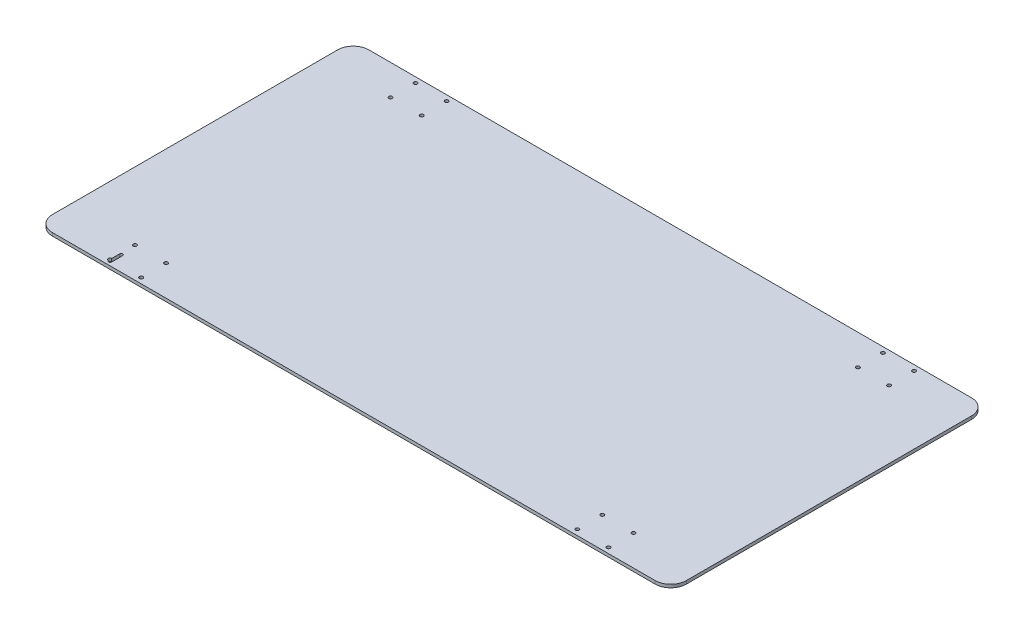
from build123d import *

# Parameters (mm, degrees)
SKETCH1_W           = 609
SKETCH1_H           = 304
SKETCH1_R           = 1.7
BOSS_EXTRUDE1_DEPTH = 3
FILLET1_R           = 15
CUT_EXTRUDE1_DEPTH  = 341.342841852


with BuildPart() as part:
    # Sketch1 → Boss-Extrude1 (new body)
    with BuildSketch(Plane(origin=(0, 0, 0), x_dir=(1, 0, 0), z_dir=(0, 1, 0))):
        Rectangle(SKETCH1_W, SKETCH1_H)
        with Locations(Location((-239.5, 146.761999999, 0), (0, 0, 270))):
            Circle(SKETCH1_R, mode=Mode.SUBTRACT)
        with Locations(Location((-209.5, 146.761999999, 0), (0, 0, 270))):
            Circle(SKETCH1_R, mode=Mode.SUBTRACT)
        with Locations(Location((-209.5, 122.761999999, 0), (0, 0, 270))):
            Circle(SKETCH1_R, mode=Mode.SUBTRACT)
        with Locations(Location((-239.5, 122.761999999, 0), (0, 0, 270))):
            Circle(SKETCH1_R, mode=Mode.SUBTRACT)
        with Locations(Location((-239.5, -122.762, 0), (0, 0, 270))):
            Circle(SKETCH1_R, mode=Mode.SUBTRACT)
        with Locations(Location((-209.5, -122.762, 0), (0, 0, 270))):
            Circle(SKETCH1_R, mode=Mode.SUBTRACT)
        with Locations(Location((-209.5, -146.762, 0), (0, 0, 270))):
            Circle(SKETCH1_R, mode=Mode.SUBTRACT)
        with Locations(Location((-239.5, -146.762, 0), (0, 0, 270))):
            Circle(SKETCH1_R, mode=Mode.SUBTRACT)
        with Locations(Location((209.500000001, -122.761999999, 0), (0, 0, 270))):
            Circle(SKETCH1_R, mode=Mode.SUBTRACT)
        with Locations(Location((239.500000001, -122.761999999, 0), (0, 0, 270))):
            Circle(SKETCH1_R, mode=Mode.SUBTRACT)
        with Locations(Location((239.500000001, -146.761999999, 0), (0, 0, 270))):
            Circle(SKETCH1_R, mode=Mode.SUBTRACT)
        with Locations(Location((209.500000001, -146.761999999, 0), (0, 0, 270))):
            Circle(SKETCH1_R, mode=Mode.SUBTRACT)
        with Locations(Location((209.500000001, 146.762, 0), (0, 0, 270))):
            Circle(SKETCH1_R, mode=Mode.SUBTRACT)
        with Locations(Location((239.500000001, 146.762, 0), (0, 0, 270))):
            Circle(SKETCH1_R, mode=Mode.SUBTRACT)
        with Locations(Location((239.500000001, 122.762, 0), (0, 0, 270))):
            Circle(SKETCH1_R, mode=Mode.SUBTRACT)
        with Locations(Location((209.500000001, 122.762, 0), (0, 0, 270))):
            Circle(SKETCH1_R, mode=Mode.SUBTRACT)
    extrude(amount=BOSS_EXTRUDE1_DEPTH)

    # Fillet1
    fillet1_edges = [part.edges().sort_by_distance(p)[0] for p in [
        (304.5, 1.5, 152),
        (-304.5, 1.5, 152),
        (-304.5, 1.5, -152),
        (304.5, 1.5, -152),
    ]]
    fillet(fillet1_edges, radius=FILLET1_R)

    # Sketch3 → Cut-Extrude1 (cut, through all)
    with BuildSketch(Plane(origin=(0, 3, 0), x_dir=(1, 0, 0), z_dir=(0, 1, 0))):
        with BuildLine():
            Line((-236.5, -137.5), (-236.5, -148))
            ThreePointArc((-236.5, -148), (-238, -149.5), (-239.5, -148))
            Line((-239.5, -148), (-239.5, -137.5))
            ThreePointArc((-239.5, -137.5), (-238, -136), (-236.5, -137.5))
        make_face()
    extrude(amount=-CUT_EXTRUDE1_DEPTH, mode=Mode.SUBTRACT)


solid = part.part
